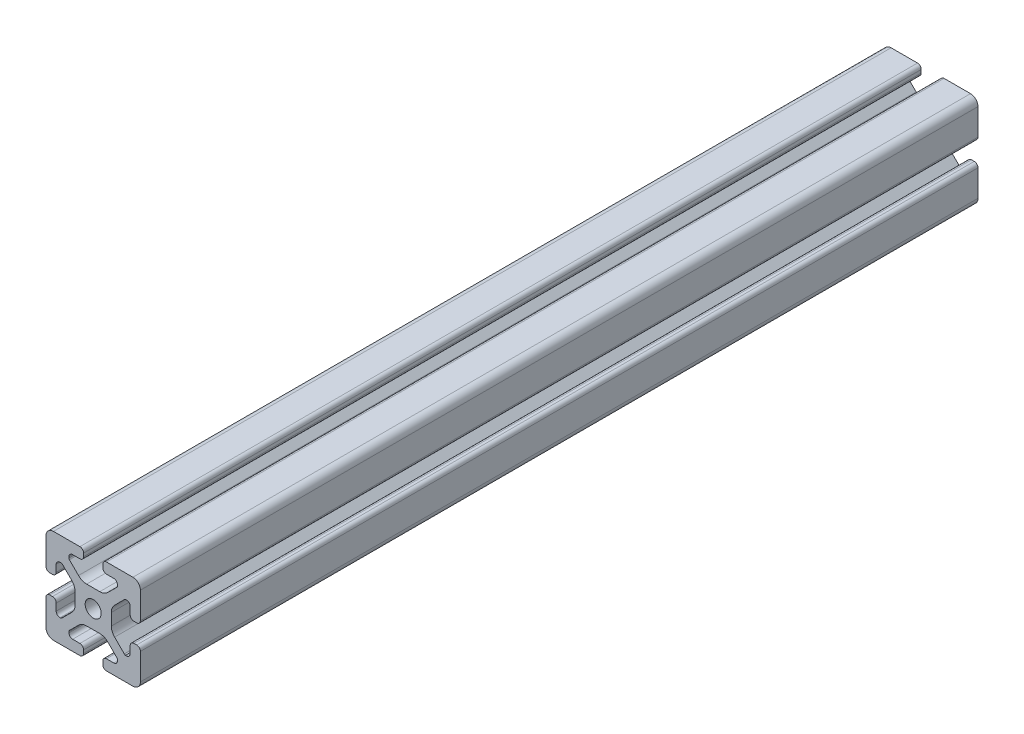
from build123d import *

# Parameters (mm, degrees)
SKETCH1_R      = 3.4
EXTRUDE1_DEPTH = 355


with BuildPart() as part:
    # Sketch1 → Extrude1 (new body)
    with BuildSketch(Plane.XY):
        with BuildLine():
            Line((-8.715, -15.524615034), (-5.63, -15.524615034))
            ThreePointArc((-5.63, -15.524615034), (-4.519842354, -15.984457388), (-4.06, -17.094615034))
            Line((-4.06, -17.094615034), (-4.06, -18.43))
            ThreePointArc((-4.06, -18.43), (-4.519842354, -19.540157646), (-5.63, -20))
            Line((-5.63, -20), (-16.674615034, -20))
            ThreePointArc((-16.674615034, -20), (-18.951578385, -19.194274381), (-20, -17.018368134))
            Line((-20, -17.018368134), (-20, -5.757918808))
            ThreePointArc((-20, -5.757918808), (-19.564709668, -4.603883664), (-18.43, -4.120449326))
            Line((-18.43, -4.120449326), (-17.25, -4.120449326))
            ThreePointArc((-17.25, -4.120449326), (-16.115287682, -4.60388249), (-15.67999625, -5.757919334))
            Line((-15.67999625, -5.757919334), (-15.67999625, -8.715399492))
            ThreePointArc((-15.67999625, -8.715399492), (-15.220153896, -9.825557139), (-14.10999625, -10.285399492))
            Line((-14.10999625, -10.285399492), (-13.816898819, -10.285399492))
            ThreePointArc((-13.816898819, -10.285399492), (-13.526061711, -10.227547119), (-13.279501941, -10.062800646))
            Line((-13.279501941, -10.062800646), (-9.076242789, -5.859541495))
            ThreePointArc((-9.076242789, -5.859541495), (-8.046572221, -4.318530588), (-7.685, -2.500784284))
            Line((-7.685, -2.500784284), (-7.685, 2.500784284))
            ThreePointArc((-7.685, 2.500784284), (-8.046572221, 4.318530588), (-9.076242789, 5.859541495))
            Line((-9.076242789, 5.859541495), (-13.040489136, 9.823787841))
            ThreePointArc((-13.040489136, 9.823787841), (-13.354224618, 10.012729352), (-13.71989919, 10.033001362))
            Line((-13.71989919, 10.033001362), (-14.05520779, 10.044710596))
            ThreePointArc((-14.05520779, 10.044710596), (-15.200613642, 9.605030484), (-15.68, 8.475666998))
            Line((-15.68, 8.475666998), (-15.68, 5.572979049))
            ThreePointArc((-15.68, 5.572979049), (-16.139842354, 4.462821403), (-17.25, 4.002979049))
            Line((-17.25, 4.002979049), (-18.43, 4.002979049))
            ThreePointArc((-18.43, 4.002979049), (-19.540157646, 4.462821403), (-20, 5.572979049))
            Line((-20, 5.572979049), (-20, 13.004526564))
            Line((-20, 13.004526564), (-20, 16.83))
            ThreePointArc((-20, 16.83), (-19.071528496, 19.071528496), (-16.83, 20))
            Line((-16.83, 20), (-5.63, 20))
            ThreePointArc((-5.63, 20), (-4.519842354, 19.540157646), (-4.06, 18.43))
            Line((-4.06, 18.43), (-4.06, 17.094615034))
            ThreePointArc((-4.06, 17.094615034), (-4.519842354, 15.984457388), (-5.63, 15.524615034))
            Line((-5.63, 15.524615034), (-8.715, 15.524615034))
            ThreePointArc((-8.715, 15.524615034), (-9.825157646, 15.06477268), (-10.285, 13.954615034))
            Line((-10.285, 13.954615034), (-10.285, 13.492503602))
            ThreePointArc((-10.285, 13.492503602), (-10.227148445, 13.201664194), (-10.062401154, 12.955102448))
            Line((-10.062401154, 12.955102448), (-6.217092793, 9.109794088))
            ThreePointArc((-6.217092793, 9.109794088), (-4.63891877, 8.055291919), (-2.777335583, 7.685))
            Line((-2.777335583, 7.685), (2.777335583, 7.685))
            ThreePointArc((2.777335583, 7.685), (4.63891877, 8.055291919), (6.217092793, 9.109794088))
            Line((6.217092793, 9.109794088), (10.062401154, 12.955102448))
            ThreePointArc((10.062401154, 12.955102448), (10.227148445, 13.201664194), (10.285, 13.492503602))
            Line((10.285, 13.492503602), (10.285, 13.954615034))
            ThreePointArc((10.285, 13.954615034), (9.825157646, 15.06477268), (8.715, 15.524615034))
            Line((8.715, 15.524615034), (5.63, 15.524615034))
            ThreePointArc((5.63, 15.524615034), (4.519842354, 15.984457388), (4.06, 17.094615034))
            Line((4.06, 17.094615034), (4.06, 18.43))
            ThreePointArc((4.06, 18.43), (4.519842354, 19.540157646), (5.63, 20))
            Line((5.63, 20), (12.979635074, 20))
            Line((12.979635074, 20), (16.83, 20))
            ThreePointArc((16.83, 20), (19.071528496, 19.071528496), (20, 16.83))
            Line((20, 16.83), (20, 13.001098436))
            Line((20, 13.001098436), (20, 5.63))
            ThreePointArc((20, 5.63), (19.540157461, 4.519842693), (18.43, 4.060000526))
            Line((18.43, 4.060000526), (17.24999625, 4.060000526))
            ThreePointArc((17.24999625, 4.060000526), (16.139838603, 4.519842879), (15.67999625, 5.630000526))
            Line((15.67999625, 5.630000526), (15.67999625, 8.715399492))
            ThreePointArc((15.67999625, 8.715399492), (15.220153896, 9.825557139), (14.10999625, 10.285399492))
            Line((14.10999625, 10.285399492), (13.816903094, 10.285399492))
            ThreePointArc((13.816903094, 10.285399492), (13.526063686, 10.227547937), (13.279501941, 10.062800646))
            Line((13.279501941, 10.062800646), (9.076242789, 5.859541495))
            ThreePointArc((9.076242789, 5.859541495), (8.046572221, 4.318530588), (7.685, 2.500784284))
            Line((7.685, 2.500784284), (7.685, -2.500784284))
            ThreePointArc((7.685, -2.500784284), (8.046572221, -4.318530588), (9.076242789, -5.859541495))
            Line((9.076242789, -5.859541495), (13.163657296, -9.946956002))
            ThreePointArc((13.163657296, -9.946956002), (13.35903797, -10.160433474), (13.6200547, -10.285399492))
            Line((13.6200547, -10.285399492), (14.10999625, -10.285399492))
            ThreePointArc((14.10999625, -10.285399492), (15.220153896, -9.825557139), (15.67999625, -8.715399492))
            Line((15.67999625, -8.715399492), (15.67999625, -5.630000526))
            ThreePointArc((15.67999625, -5.630000526), (16.139838603, -4.519842879), (17.24999625, -4.060000526))
            Line((17.24999625, -4.060000526), (18.43, -4.060000526))
            ThreePointArc((18.43, -4.060000526), (19.540157461, -4.519842693), (20, -5.63))
            Line((20, -5.63), (20, -16.83))
            ThreePointArc((20, -16.83), (19.071528496, -19.071528496), (16.83, -20))
            Line((16.83, -20), (13, -20))
            Line((13, -20), (5.63, -20))
            ThreePointArc((5.63, -20), (4.519842354, -19.540157646), (4.06, -18.43))
            Line((4.06, -18.43), (4.06, -17.094615034))
            ThreePointArc((4.06, -17.094615034), (4.519842354, -15.984457388), (5.63, -15.524615034))
            Line((5.63, -15.524615034), (8.715, -15.524615034))
            ThreePointArc((8.715, -15.524615034), (9.825157646, -15.06477268), (10.285, -13.954615034))
            Line((10.285, -13.954615034), (10.285, -13.492503602))
            ThreePointArc((10.285, -13.492503602), (10.227148445, -13.201664194), (10.062401154, -12.955102448))
            Line((10.062401154, -12.955102448), (6.217092793, -9.109794088))
            ThreePointArc((6.217092793, -9.109794088), (4.63891877, -8.055291919), (2.777335583, -7.685))
            Line((2.777335583, -7.685), (-2.777335583, -7.685))
            ThreePointArc((-2.777335583, -7.685), (-4.63891877, -8.055291919), (-6.217092793, -9.109794088))
            Line((-6.217092793, -9.109794088), (-10.062401154, -12.955102448))
            ThreePointArc((-10.062401154, -12.955102448), (-10.227148445, -13.201664194), (-10.285, -13.492503602))
            Line((-10.285, -13.492503602), (-10.285, -13.954615034))
            ThreePointArc((-10.285, -13.954615034), (-9.825157646, -15.06477268), (-8.715, -15.524615034))
        make_face()
        Circle(SKETCH1_R, mode=Mode.SUBTRACT)
    extrude(amount=-EXTRUDE1_DEPTH)


solid = part.part
